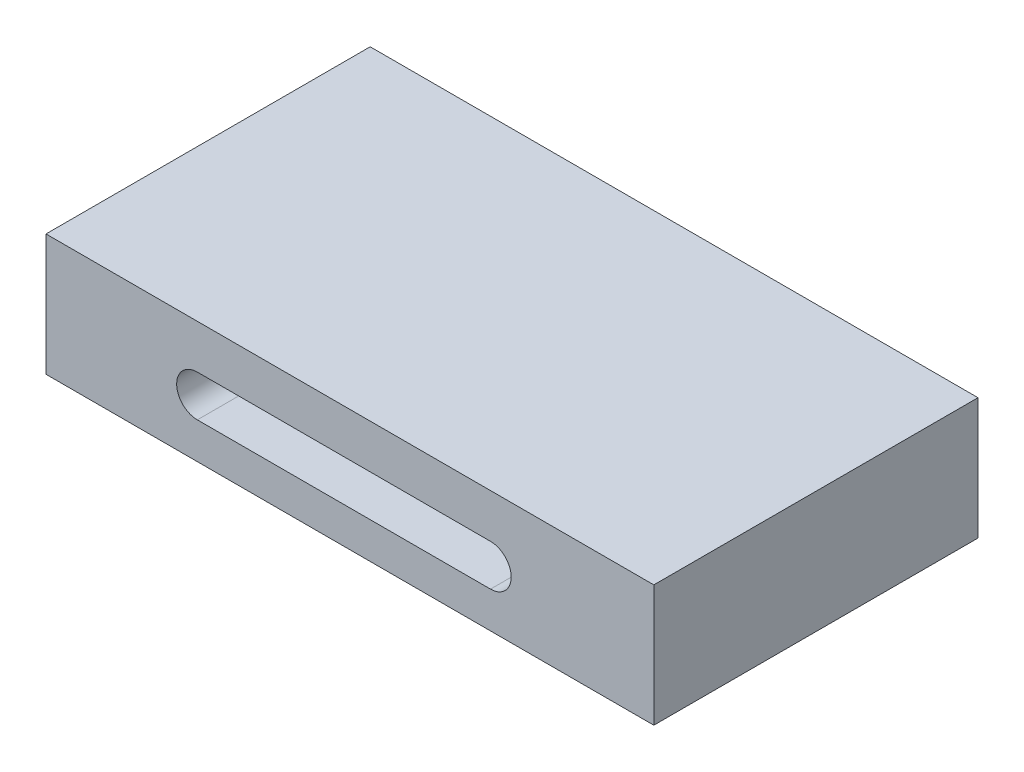
from build123d import *

# Parameters (mm, degrees)
SKETCH1_W           = 15
SKETCH1_H           = 8
BOSS_EXTRUDE1_DEPTH = 3
CUT_EXTRUDE2_DEPTH  = 13


with BuildPart() as part:
    # Sketch1 → Boss-Extrude1 (new body)
    with BuildSketch(Plane(origin=(0, 0, 0), x_dir=(1, 0, 0), z_dir=(0, 1, 0))):
        with Locations((-7.5, 4)):
            Rectangle(SKETCH1_W, SKETCH1_H)
    extrude(amount=BOSS_EXTRUDE1_DEPTH)

    # Sketch19 → Cut-Extrude2 (cut)
    with BuildSketch(Plane(origin=(0, 0, -8), x_dir=(-1, 0, 0), z_dir=(0, 0, -1))):
        with BuildLine():
            Line((11.265287709, 0.893944687), (4.030284254, 0.893944687))
            ThreePointArc((4.030284254, 0.893944687), (3.519918662, 1.40431028), (4.030284254, 1.914675872))
            Line((4.030284254, 1.914675872), (11.265287709, 1.914675872))
            ThreePointArc((11.265287709, 1.914675872), (11.775653301, 1.40431028), (11.265287709, 0.893944687))
        make_face()
    extrude(amount=-CUT_EXTRUDE2_DEPTH, mode=Mode.SUBTRACT)


solid = part.part
